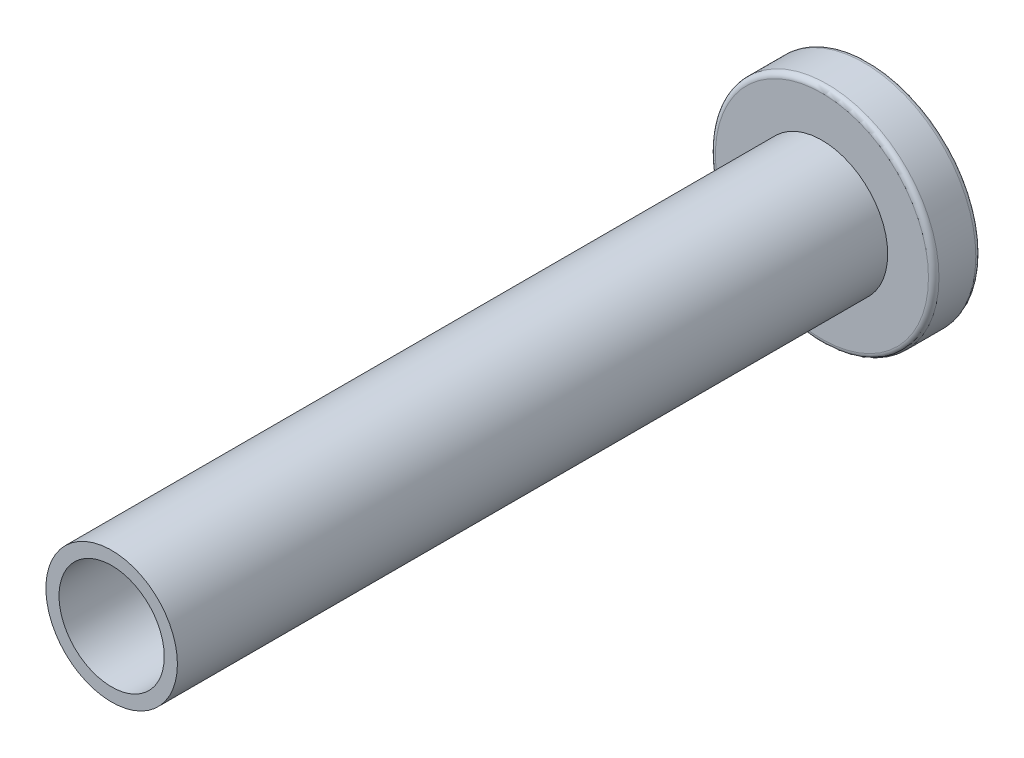
from build123d import *

# Parameters (mm, degrees)
SKETCH_1_R          = 4.25
EXTRUDE_1_DEPTH     = 1.8
SKETCH_2_R          = 2.5
SKETCH_2_R_2        = 2
EXTRUDE_2_DEPTH     = 27
FILLET_1_R          = 0.2
CUT_EXTRUDE_1_DEPTH = 1.5


with BuildPart() as part:
    # 草图1 → 凸台-拉伸1 (new body)
    with BuildSketch(Plane.XY):
        Circle(SKETCH_1_R)
    extrude(amount=EXTRUDE_1_DEPTH)

    # 草图2 → 凸台-拉伸2 (add)
    with BuildSketch(Plane.XY.offset(1.8)):
        Circle(SKETCH_2_R)
        Circle(SKETCH_2_R_2, mode=Mode.SUBTRACT)
    extrude(amount=EXTRUDE_2_DEPTH)

    # 圆角1
    fillet_1_edges = [part.edges().sort_by_distance(p)[0] for p in [
        (-4.25, 0, 0),
        (-4.25, 0, 1.8),
    ]]
    fillet(fillet_1_edges, radius=FILLET_1_R)

    # 草图3 → 切除-拉伸1 (cut)
    with BuildSketch(Plane(origin=(0, 0, 0), x_dir=(-1, 0, 0), z_dir=(0, 0, -1))):
        Polygon((1.443375673, 0), (0.721687836, 1.25), (-0.721687836, 1.25), (-1.443375673, 0), (-0.721687836, -1.25), (0.721687836, -1.25), align=None)
    extrude(amount=-CUT_EXTRUDE_1_DEPTH, mode=Mode.SUBTRACT)


solid = part.part
